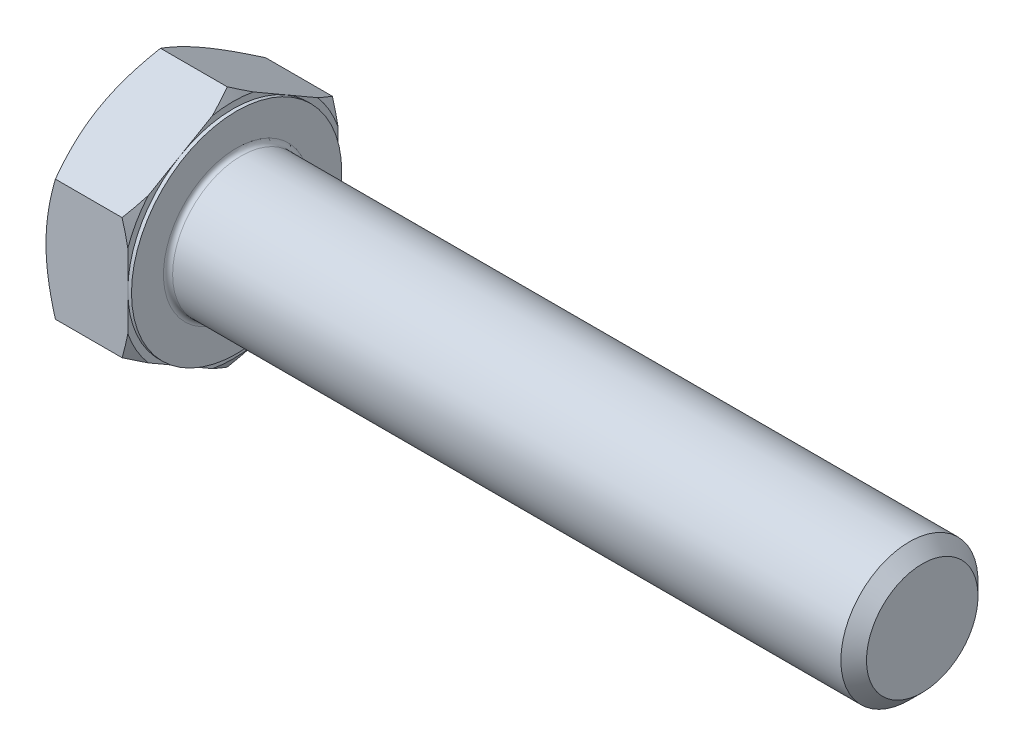
from build123d import *

# Parameters (mm, degrees)
EXTRUDE_373_DEPTH = 18.7
SKETCH_4_W        = 0.8
SKETCH_4_H        = 13.558112383
CHAMFER_2081_SIZE = 2.8
FILLET_2126_R     = 1


with BuildPart() as part:
    # 草图1 → Extrude 373 (new body)
    with BuildSketch(Plane(origin=(0, 0, 0), x_dir=(0, 0, -1), z_dir=(1, 0, 0))):
        Polygon((23, 13.279056191), (23, -13.279056191), (0, -26.558112383), (-23, -13.279056191), (-23, 13.279056191), (0, 26.558112383), align=None)
    extrude(amount=EXTRUDE_373_DEPTH)

    # 草图2 → 凸台-旋转1 (revolve)
    with BuildSketch(Plane.XY, mode=Mode.PRIVATE) as revolve_1_sk:
        Polygon((0, 0), (168.7, 0), (168.7, 11.969), (168.7, 15), (27.8072, 15), (0, 15), align=None)
    revolve(revolve_1_sk.sketch.rotate(Axis((0, 0, 0), (1, 0, 0)), 90), axis=Axis((0, 0, 0), (1, 0, 0)))

    # 草图3 → 切除-旋转1 (revolve, cut)
    with BuildSketch(Plane.XY):
        Polygon((0, 23), (4.941028488, 31.558112383), (4.941028488, 36.558112383), (-10, 36.558112383), (-10, 23), align=None)
    revolve(axis=Axis((0, 0, 0), (1, 0, 0)), mode=Mode.SUBTRACT)

    # 草图5 → 切除-旋转2 (revolve, cut)
    with BuildSketch(Plane.XY):
        Polygon((18.7, 23), (13.758971512, 31.558112383), (13.758971512, 36.558112383), (23.758971512, 36.558112383), (23.758971512, 23), align=None)
    revolve(axis=Axis((0, 0, 0), (1, 0, 0)), mode=Mode.SUBTRACT)

    # 草图4 → 切除-旋转3 (revolve, cut)
    with BuildSketch(Plane.XY, mode=Mode.PRIVATE) as cut_revolve_3_sk:
        with Locations((18.3, 29.779056192)):
            Rectangle(SKETCH_4_W, SKETCH_4_H)
    revolve(cut_revolve_3_sk.sketch.rotate(Axis((0, 0, 0), (1, 0, 0)), 270), axis=Axis((0, 0, 0), (1, 0, 0)), mode=Mode.SUBTRACT)

    # Chamfer 2081
    chamfer_2081_edges = [part.edges().sort_by_distance(p)[0] for p in [
        (168.7, 0, -15),
    ]]
    chamfer(chamfer_2081_edges, length=CHAMFER_2081_SIZE)

    # Fillet 2126
    fillet_2126_edges = [part.edges().sort_by_distance(p)[0] for p in [
        (18.7, 0, -15),
    ]]
    fillet(fillet_2126_edges, radius=FILLET_2126_R)


solid = part.part
